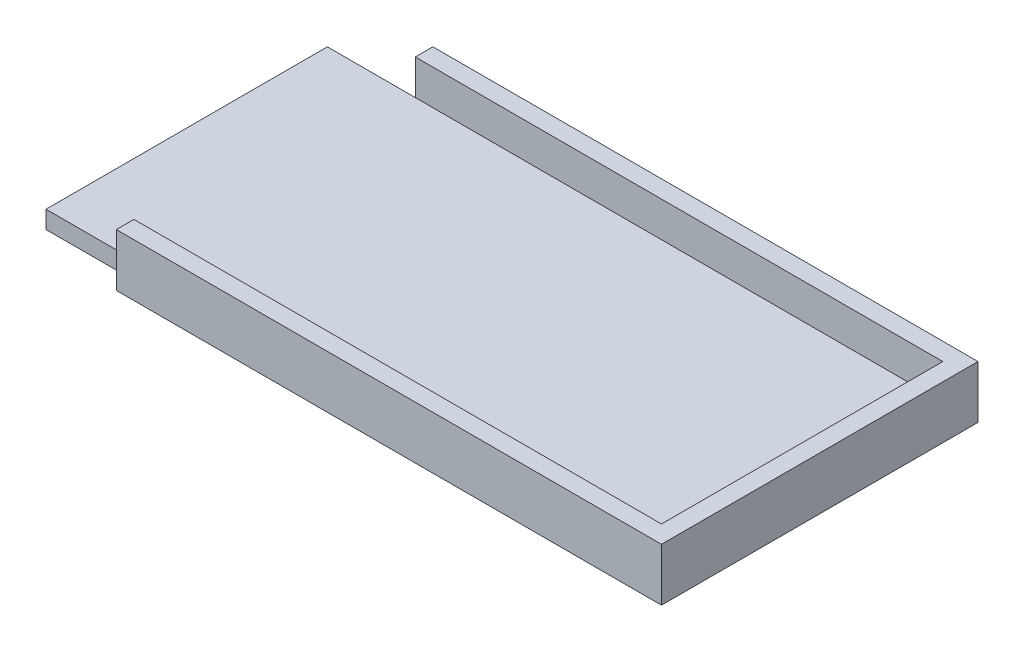
from build123d import *

# Parameters (mm, degrees)
SKETCH1_W           = 60
SKETCH1_H           = 32
BOSS_EXTRUDE1_DEPTH = 2
BOSS_EXTRUDE2_DEPTH = 6
SKETCH3_W           = 10
SKETCH3_H           = 32
BOSS_EXTRUDE3_DEPTH = 2


with BuildPart() as part:
    # Sketch1 → Boss-Extrude1 (new body)
    with BuildSketch(Plane(origin=(0, 0, 0), x_dir=(1, 0, 0), z_dir=(0, 1, 0))):
        Rectangle(SKETCH1_W, SKETCH1_H)
    extrude(amount=BOSS_EXTRUDE1_DEPTH)

    # Sketch2 → Boss-Extrude2 (add)
    with BuildSketch(Plane.XZ):
        Polygon((-30, -18), (32, -18), (32, 18), (-30, 18), (-30, 16), (30, 16), (30, -16), (-30, -16), align=None)
    extrude(amount=-BOSS_EXTRUDE2_DEPTH)

    # Sketch3 → Boss-Extrude3 (add)
    with BuildSketch(Plane.XZ):
        with Locations((-35, 0)):
            Rectangle(SKETCH3_W, SKETCH3_H)
    extrude(amount=-BOSS_EXTRUDE3_DEPTH)


solid = part.part
